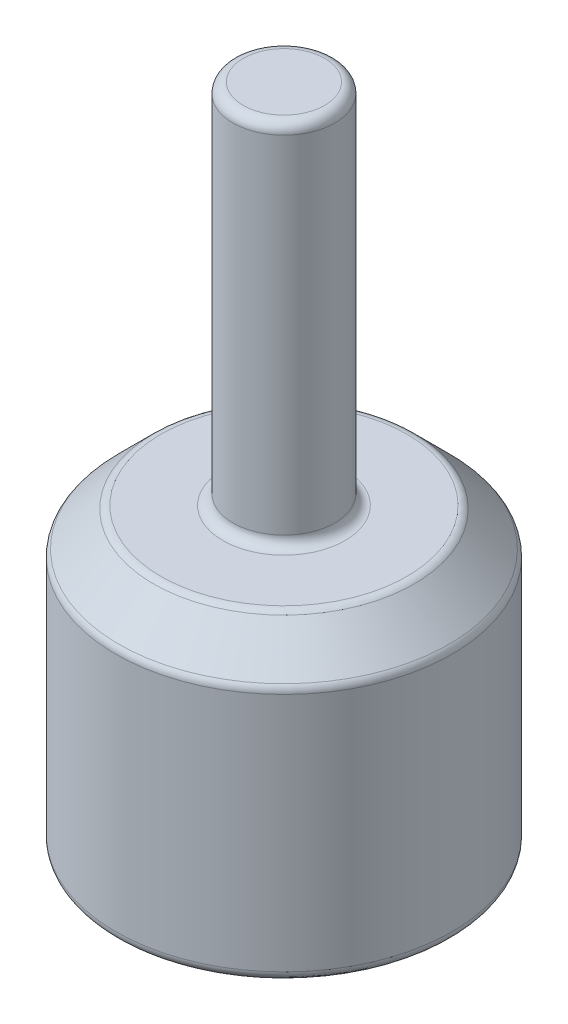
from build123d import *


with BuildPart() as part:
    # Sketch1 → Revolve1 (revolve)
    with BuildSketch(Plane.XY, mode=Mode.PRIVATE) as revolve1_sk:
        with BuildLine():
            ThreePointArc((8.25, -32), (8.103553391, -32.353553391), (7.75, -32.5))
            Line((7.75, -32.5), (7.25, -32.5))
            ThreePointArc((7.25, -32.5), (3.834465413, -34.357449696), (0, -35))
            Line((0, -35), (0, 0))
            Line((0, 0), (2, 0))
            ThreePointArc((2, 0), (2.353553391, -0.146446609), (2.5, -0.5))
            Line((2.5, -0.5), (2.5, -17.5))
            ThreePointArc((2.5, -17.5), (2.646446609, -17.853553391), (3, -18))
            Line((3, -18), (6.042893219, -18))
            ThreePointArc((6.042893219, -18), (6.234234935, -18.038060234), (6.396446609, -18.146446609))
            Line((6.396446609, -18.146446609), (8.103553391, -19.853553391))
            ThreePointArc((8.103553391, -19.853553391), (8.211939766, -20.015765065), (8.25, -20.207106781))
            Line((8.25, -20.207106781), (8.25, -32))
        make_face()
    revolve(revolve1_sk.sketch.rotate(Axis((0, 0, 0), (0, -1, 0)), 180), axis=Axis((0, 0, 0), (0, -1, 0)))


solid = part.part
